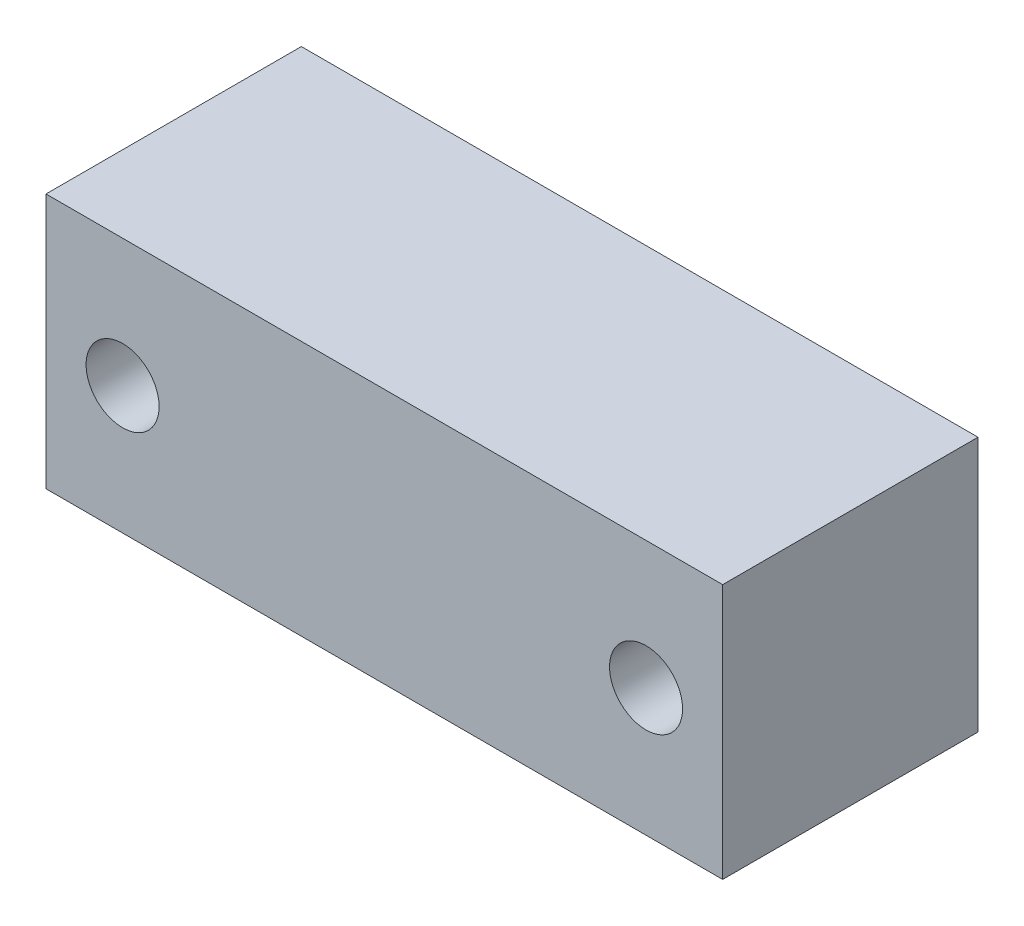
from build123d import *

# Parameters (mm, degrees)
SKETCH_1_W         = 53
SKETCH_1_H         = 20
EXTRUDE_1_DEPTH    = 20
HOLE_WIZARD_M4_1_D = 5.72


with BuildPart() as part:
    # 스케치1 → 보스-돌출1 (new body)
    with BuildSketch(Plane.XY):
        Rectangle(SKETCH_1_W, SKETCH_1_H)
    extrude(amount=EXTRUDE_1_DEPTH)

    # M4 여유 구멍1 (through all)
    with Locations(Plane.XY.offset(20)):
        with Locations((-20.5, 0), (20.5, 0)):
            Hole(HOLE_WIZARD_M4_1_D / 2)


solid = part.part
